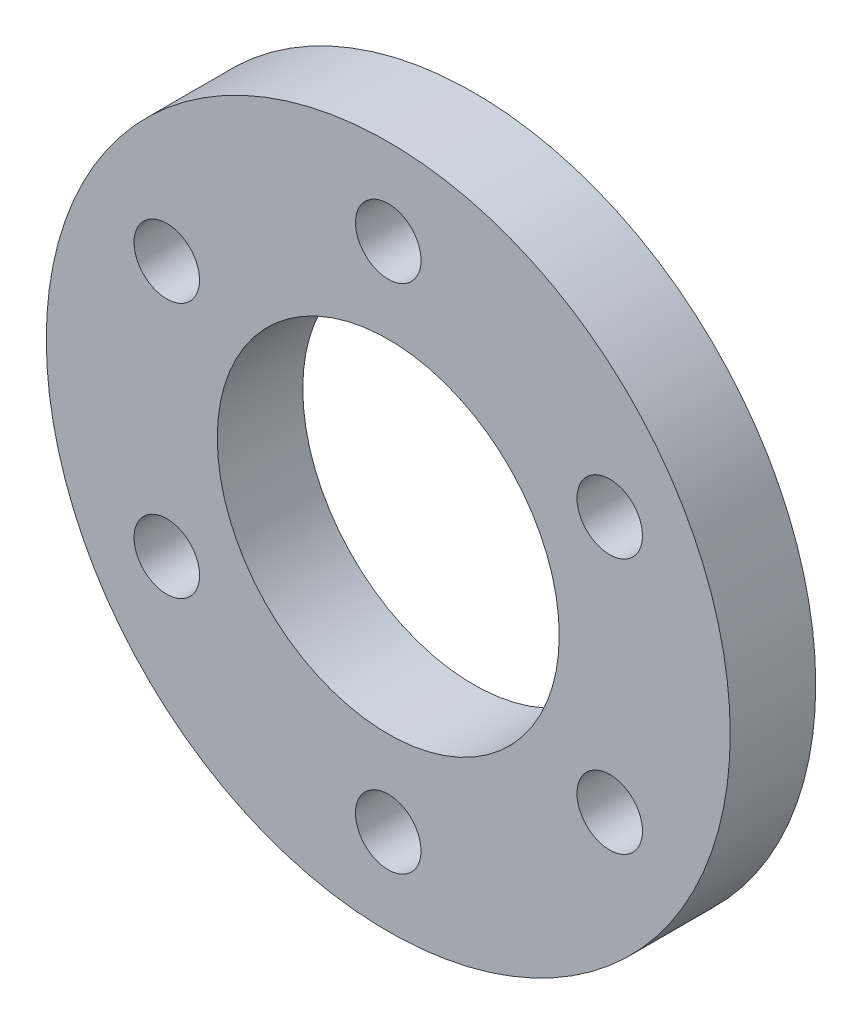
from build123d import *

# Parameters (mm, degrees)
SKETCH1_R           = 40
SKETCH1_R_2         = 20
BOSS_EXTRUDE1_DEPTH = 10
SKETCH2_R           = 3.831489411
CUT_EXTRUDE1_DEPTH  = 10
CIRPATTERN1_COUNT   = 6


with BuildPart() as part:
    # Sketch1 → Boss-Extrude1 (new body)
    with BuildSketch(Plane.XY):
        Circle(SKETCH1_R)
        Circle(SKETCH1_R_2, mode=Mode.SUBTRACT)
    extrude(amount=BOSS_EXTRUDE1_DEPTH)

    # Sketch2 → Cut-Extrude1 (cut)
    with BuildSketch(Plane.XY.offset(10)):
        with Locations((0, 29.911239538)):
            Circle(SKETCH2_R)
    cut_extrude1 = extrude(amount=-CUT_EXTRUDE1_DEPTH, mode=Mode.SUBTRACT)

    # CirPattern1: Cut-Extrude1 ×6 about axis
    cirpattern1_axis = Axis((0, 0, 0), (0, 0, 1))
    for i in range(1, CIRPATTERN1_COUNT):
        add(cut_extrude1.rotate(cirpattern1_axis, i * 360 / CIRPATTERN1_COUNT), mode=Mode.SUBTRACT)


solid = part.part
